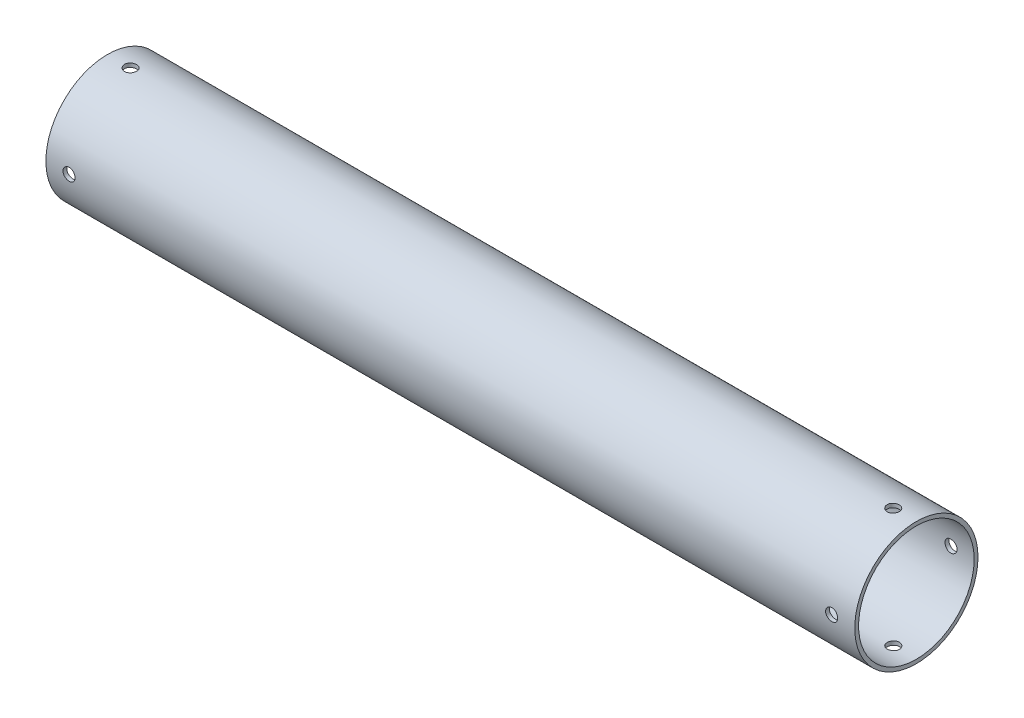
from build123d import *

# Parameters (mm, degrees)
SKETCH1_R               = 25.4
SKETCH1_R_2             = 23.8125
EXTRUDE_THIN1_DEPTH     = 166.6875
CUT_EXTRUDE1_DEPTH      = 171.514054131
CUT_EXTRUDE1_DEPTH_BACK = 171.514054131
SKETCH3_R               = 2.4892
CUT_EXTRUDE2_DEPTH      = 171.514054259
CUT_EXTRUDE2_DEPTH_BACK = 171.514054259
SKETCH4_R               = 2.4892


with BuildPart() as part:
    # Sketch1 → Extrude-Thin1 (new, symmetric)
    with BuildSketch(Plane(origin=(0, 0, 0), x_dir=(0, 0, -1), z_dir=(1, 0, 0))):
        Circle(SKETCH1_R)
        Circle(SKETCH1_R_2, mode=Mode.SUBTRACT)
    extrude(amount=EXTRUDE_THIN1_DEPTH, both=True)

    # Sketch3 → Cut-Extrude1 (cut, two sides: drawn at the far end of the back side and taken through both)
    with BuildSketch(Plane.XY.offset(-CUT_EXTRUDE1_DEPTH_BACK)):
        with Locations((-157.1625, 0)):
            Circle(SKETCH3_R)
        with Locations((157.1625, 0)):
            Circle(SKETCH3_R)
    extrude(amount=CUT_EXTRUDE1_DEPTH + CUT_EXTRUDE1_DEPTH_BACK, mode=Mode.SUBTRACT)

    # Sketch4 → Cut-Extrude2 (cut, two sides: drawn at the far end of the back side and taken through both)
    with BuildSketch(Plane(origin=(0, 0, 0), x_dir=(1, 0, 0), z_dir=(0, 1, 0)).offset(-CUT_EXTRUDE2_DEPTH_BACK)):
        with Locations(Location((-157.1625, 0, 0), (0, 0, 270))):
            Circle(SKETCH4_R)
        with Locations(Location((157.1625, 0, 0), (0, 0, 270))):
            Circle(SKETCH4_R)
    extrude(amount=CUT_EXTRUDE2_DEPTH + CUT_EXTRUDE2_DEPTH_BACK, mode=Mode.SUBTRACT)


solid = part.part
